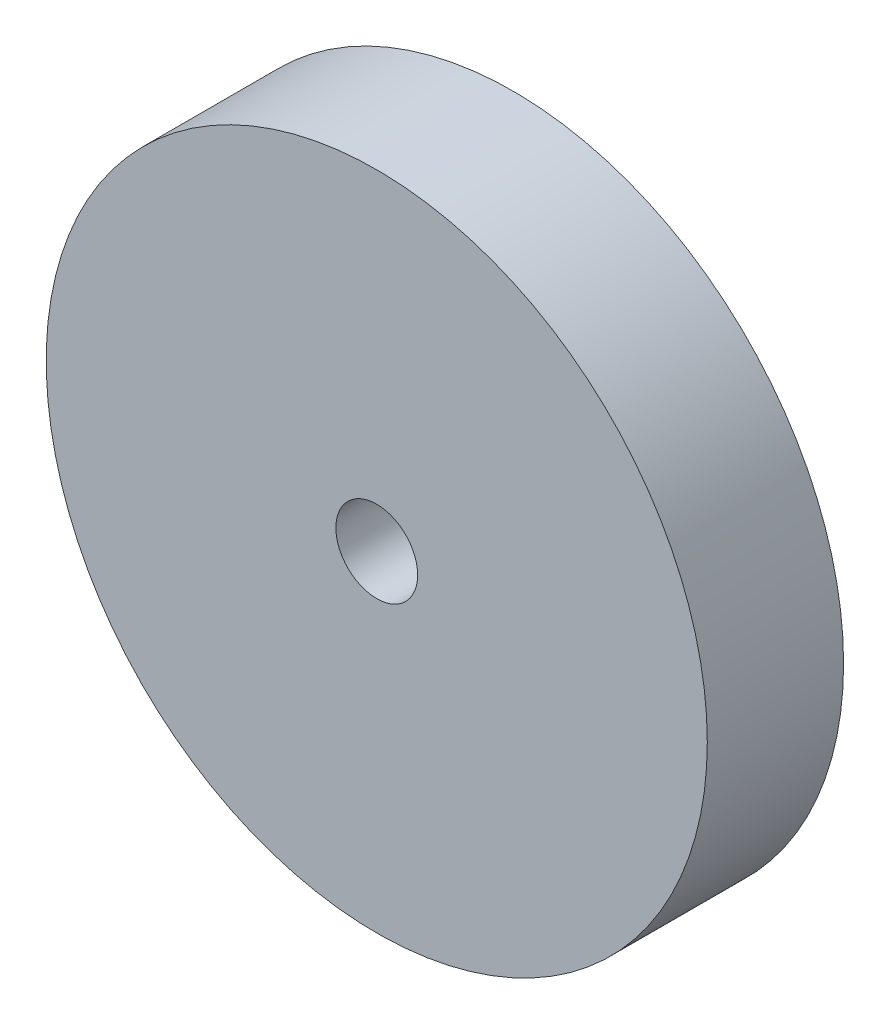
from build123d import *

# Parameters (mm, degrees)
SKETCH1_R           = 48.5
SKETCH1_R_2         = 6
BOSS_EXTRUDE1_DEPTH = 20


with BuildPart() as part:
    # Sketch1 → Boss-Extrude1 (new body)
    with BuildSketch(Plane.XY):
        Circle(SKETCH1_R)
        Circle(SKETCH1_R_2, mode=Mode.SUBTRACT)
    extrude(amount=BOSS_EXTRUDE1_DEPTH)


solid = part.part
